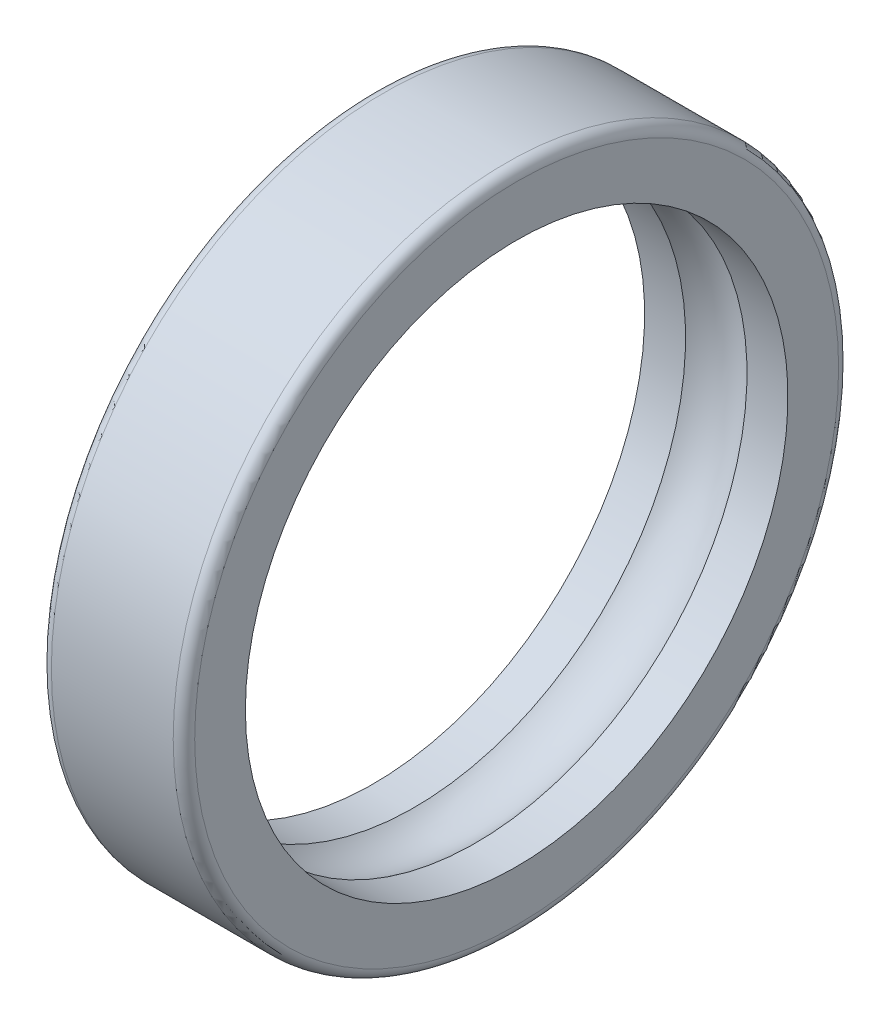
from build123d import *

# Parameters (mm, degrees)
FILLET1_R = 2.1


with BuildPart() as part:
    # Sketch1 → Revolve1 (revolve)
    with BuildSketch(Plane.XY, mode=Mode.PRIVATE) as revolve1_sk:
        with BuildLine():
            Line((-14, 65), (14, 65))
            Line((14, 65), (14, 53))
            Line((14, 53), (6, 53))
            ThreePointArc((6, 53), (0, 55), (-6, 53))
            Line((-6, 53), (-14, 53))
            Line((-14, 53), (-14, 65))
        make_face()
    revolve(revolve1_sk.sketch.rotate(Axis((-24.592808126, 0, 0), (1, 0, 0)), 90), axis=Axis((-24.592808126, 0, 0), (1, 0, 0)))

    # Fillet1
    fillet1_edges = [part.edges().sort_by_distance(p)[0] for p in [
        (14, 0, -65),
        (-14, 0, -65),
    ]]
    fillet(fillet1_edges, radius=FILLET1_R)


solid = part.part
